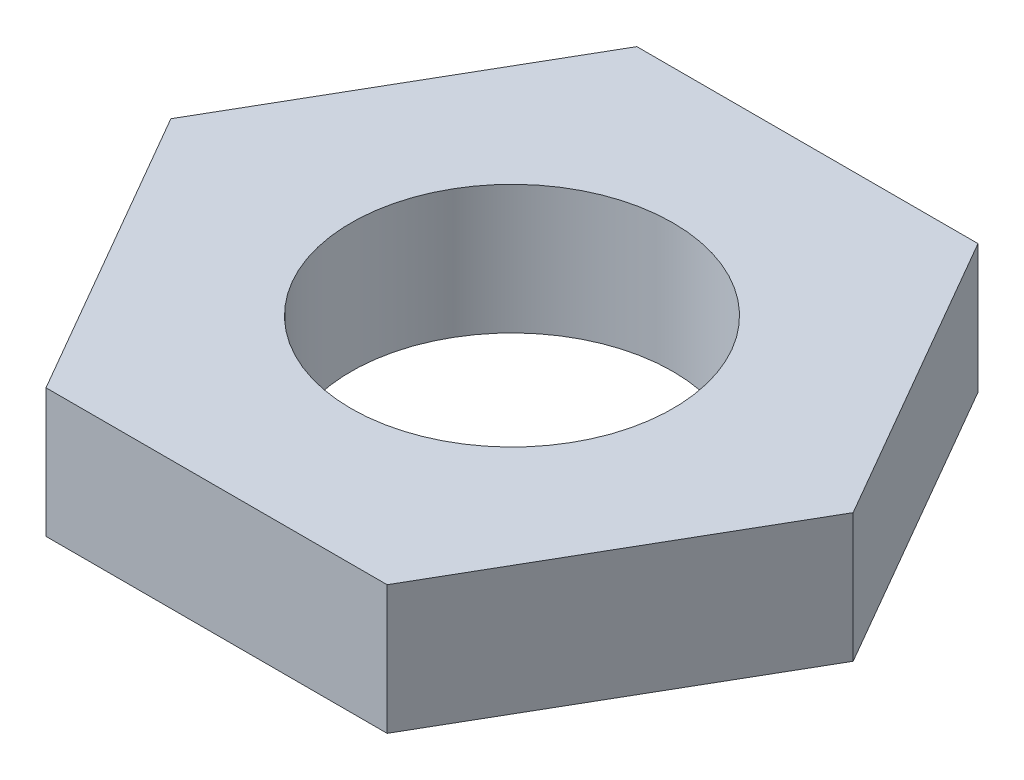
from build123d import *

# Parameters (mm, degrees)
EXTRUDE_1_DEPTH     = 1
SKETCH_7_R          = 1.25
CUT_EXTRUDE_1_DEPTH = 5


with BuildPart() as part:
    # 草图4 → 凸台-拉伸1 (new body)
    with BuildSketch(Plane(origin=(0, 0, 0), x_dir=(1, 0, 0), z_dir=(0, 1, 0))):
        Polygon((1.325, -2.29496732), (2.65, 0), (1.325, 2.29496732), (-1.325, 2.29496732), (-2.65, 0), (-1.325, -2.29496732), align=None)
    extrude(amount=EXTRUDE_1_DEPTH)

    # 草图7 → 切除-拉伸1 (cut)
    with BuildSketch(Plane(origin=(0, 1, 0), x_dir=(1, 0, 0), z_dir=(0, 1, 0))):
        with Locations(Location((0, 0, 0), (0, 0, 270))):
            Circle(SKETCH_7_R)
    extrude(amount=-CUT_EXTRUDE_1_DEPTH, mode=Mode.SUBTRACT)


solid = part.part
